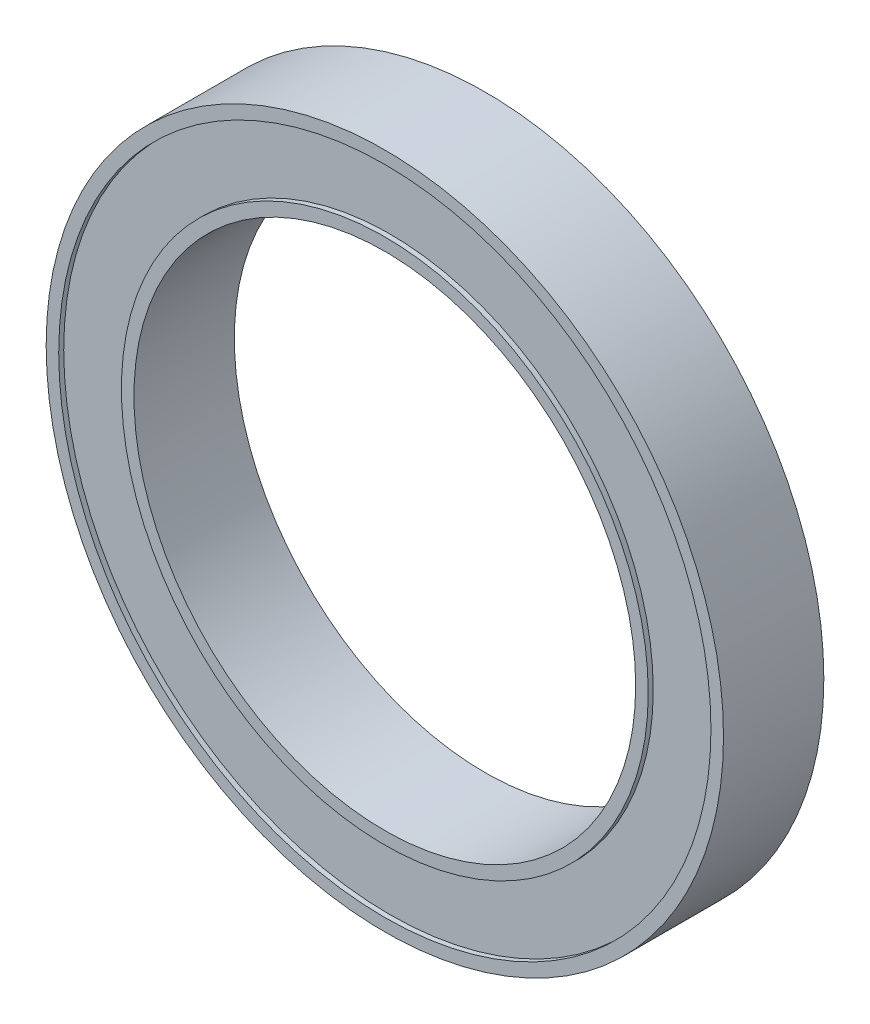
from build123d import *

# Parameters (mm, degrees)
SKETCH1_R          = 10.5
SKETCH1_R_2        = 10
EXTRUSION1_DEPTH   = 4
SKETCH1_R_3        = 13.5
SKETCH1_R_4        = 13
EXTRUSION1_2_DEPTH = 4
SKETCH2_R          = 13
SKETCH2_R_2        = 10.5
EXTRUSION2_DEPTH   = 3.6


with BuildPart() as part:
    # Sketch1 → Extrusion1 (new body)
    with BuildSketch(Plane.XY):
        Circle(SKETCH1_R)
        Circle(SKETCH1_R_2, mode=Mode.SUBTRACT)
    extrude(amount=EXTRUSION1_DEPTH)



with BuildPart() as body_2:
    # Sketch1 → Extrusion1 2 (new body)
    with BuildSketch(Plane.XY):
        Circle(SKETCH1_R_3)
        Circle(SKETCH1_R_4, mode=Mode.SUBTRACT)
    extrude(amount=EXTRUSION1_2_DEPTH)


with BuildPart() as part_1:
    add(part.part)

    add(body_2.part)  # Extrusion2 merges body 2
    # Sketch2 → Extrusion2 (add)
    with BuildSketch(Plane.XY.offset(0.2)):
        Circle(SKETCH2_R)
        Circle(SKETCH2_R_2, mode=Mode.SUBTRACT)
    extrude(amount=EXTRUSION2_DEPTH)


solid = part_1.part
